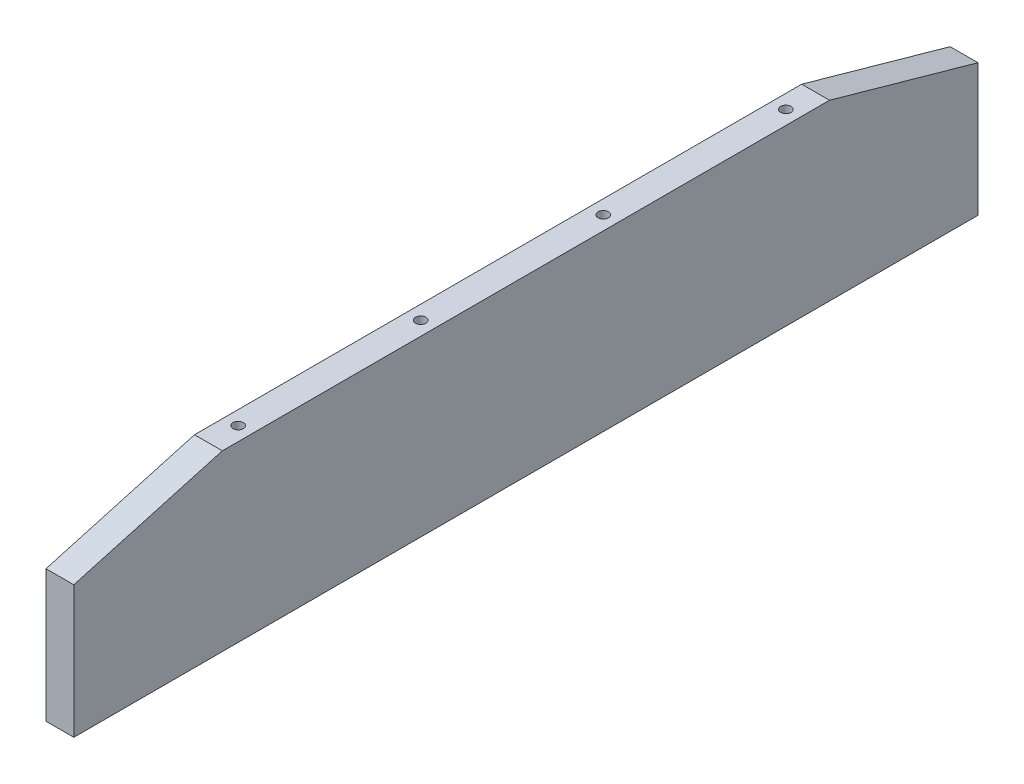
from build123d import *

# Parameters (mm, degrees)
BOSS_EXTRUDE1_DEPTH = 8
SKETCH6_R           = 1.5
CUT_EXTRUDE2_DEPTH  = 50


with BuildPart() as part:
    # Sketch1 → Boss-Extrude1 (new body)
    with BuildSketch(Plane(origin=(0, 0, 0), x_dir=(0, 0, -1), z_dir=(1, 0, 0))):
        Polygon((-25, 0), (235, 0), (235, 37.995251441), (192.301615505, 50), (17.698384495, 50), (-25, 37.995251441), align=None)
    extrude(amount=BOSS_EXTRUDE1_DEPTH)

    # Sketch6 → Cut-Extrude2 (cut)
    with BuildSketch(Plane.XZ):
        with Locations(Location((4, -26.25, 0), (0, 0, 270))):
            Circle(SKETCH6_R)
        with Locations(Location((4, -78.75, 0), (0, 0, 270))):
            Circle(SKETCH6_R)
        with Locations(Location((4, -131.25, 0), (0, 0, 270))):
            Circle(SKETCH6_R)
        with Locations(Location((4, -183.75, 0), (0, 0, 270))):
            Circle(SKETCH6_R)
    extrude(amount=-CUT_EXTRUDE2_DEPTH, mode=Mode.SUBTRACT)


solid = part.part
